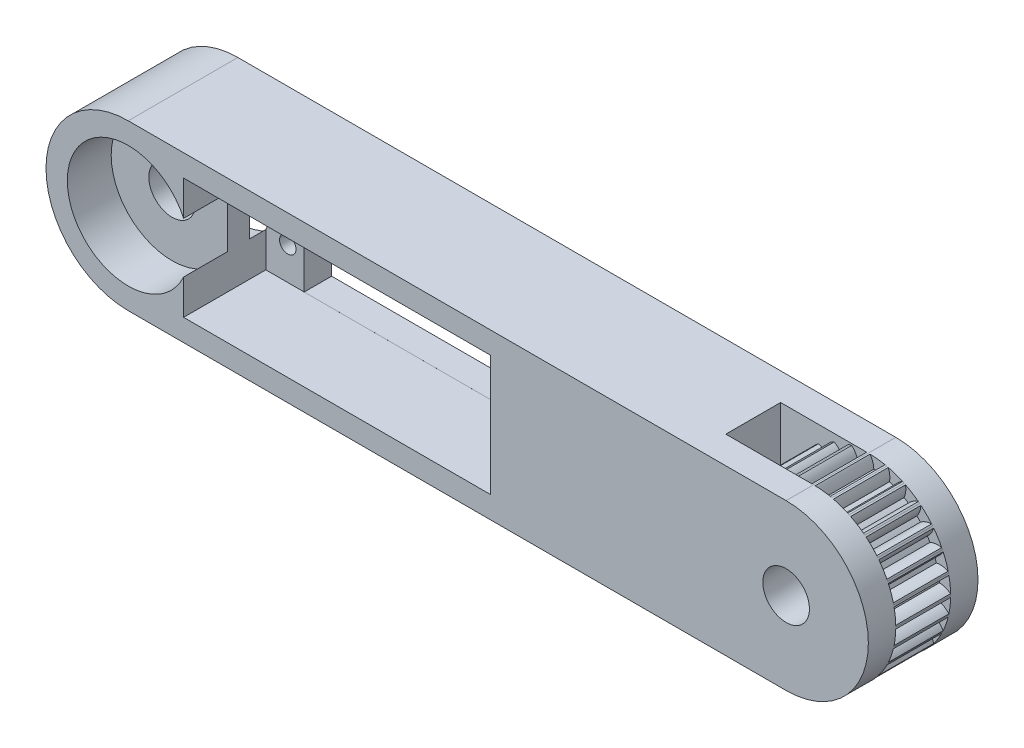
from build123d import *

# Parameters (mm, degrees)
BOSS_EXTRUDE1_DEPTH = 10
SKETCH3_R           = 4.25
CUT_EXTRUDE5_DEPTH  = 138.295302177
SKETCH4_R           = 4.25
SKETCH4_W           = 42
SKETCH4_H           = 22
CUT_EXTRUDE8_DEPTH  = 138.295302177
SKETCH5_R           = 11.11
CUT_EXTRUDE10_DEPTH = 8
SKETCH7_W           = 56
SKETCH7_H           = 22.002715538
CUT_EXTRUDE12_DEPTH = 15
SKETCH8_R           = 1.5
CUT_EXTRUDE13_DEPTH = 14
CUT_EXTRUDE17_DEPTH = 5
BOSS_EXTRUDE2_START = -5
SKETCH3_6_R         = 4.25
BOSS_EXTRUDE2_DEPTH = 10
BOSS_EXTRUDE3_START = -5
BOSS_EXTRUDE3_DEPTH = 10
CIRPATTERN1_COUNT   = 28
SKETCH10_R          = 9.5
CUT_EXTRUDE15_DEPTH = 5
SKETCH11_R          = 3.5
CUT_EXTRUDE16_DEPTH = 2


with BuildPart() as part:
    # Sketch1 → Boss-Extrude1 (new, symmetric)
    with BuildSketch(Plane.XY):
        with BuildLine():
            Line((120, 15), (0, 15))
            ThreePointArc((0, 15), (-15, 0), (0, -15))
            Line((0, -15), (120, -15))
            ThreePointArc((120, -15), (135, 0), (120, 15))
        make_face()
    extrude(amount=BOSS_EXTRUDE1_DEPTH, both=True)

    # Sketch3 → Cut-Extrude5 (cut, through all)
    with BuildSketch(Plane.XY.offset(10)):
        with Locations((120, 0)):
            Circle(SKETCH3_R)
    extrude(amount=-CUT_EXTRUDE5_DEPTH, mode=Mode.SUBTRACT)

    # Sketch4 → Cut-Extrude8 (cut, through all)
    with BuildSketch(Plane.XY.offset(10)):
        Circle(SKETCH4_R)
        with Locations((38.1, 0)):
            Rectangle(SKETCH4_W, SKETCH4_H)
    extrude(amount=-CUT_EXTRUDE8_DEPTH, mode=Mode.SUBTRACT)

    # Sketch5 → Cut-Extrude10 (cut)
    with BuildSketch(Plane(origin=(0, 0, -10), x_dir=(-1, 0, 0), z_dir=(0, 0, -1))):
        Circle(SKETCH5_R)
    cut_extrude10 = extrude(amount=-CUT_EXTRUDE10_DEPTH, mode=Mode.SUBTRACT)

    # Mirror2: Cut-Extrude10 across plane
    add(cut_extrude10.mirror(Plane.XY), mode=Mode.SUBTRACT)

    # Sketch7 → Cut-Extrude12 (cut)
    with BuildSketch(Plane.XY.offset(10)):
        with Locations((38.1, 0)):
            Rectangle(SKETCH7_W, SKETCH7_H)
    extrude(amount=-CUT_EXTRUDE12_DEPTH, mode=Mode.SUBTRACT)

    # Sketch8 → Cut-Extrude13 (cut)
    with BuildSketch(Plane.XY.offset(-5)):
        with Locations((14.1, 5)):
            Circle(SKETCH8_R)
        with Locations((14.1, -5)):
            Circle(SKETCH8_R)
        with Locations((62.1, -5)):
            Circle(SKETCH8_R)
        with Locations((62.1, 5)):
            Circle(SKETCH8_R)
    extrude(amount=-CUT_EXTRUDE13_DEPTH, mode=Mode.SUBTRACT)

    # Sketch13 → Cut-Extrude17 (cut, symmetric)
    with BuildSketch(Plane.XY):
        with BuildLine():
            Line((120, 15), (104, 15))
            Line((104, 15), (104, -15))
            Line((104, -15), (120, -15))
            ThreePointArc((120, -15), (135, 0), (120, 15))
        make_face()
    extrude(amount=CUT_EXTRUDE17_DEPTH, both=True, mode=Mode.SUBTRACT)

    # Sketch3<6> → Boss-Extrude2 (add)
    with BuildSketch(Plane.XY.offset(10).offset(BOSS_EXTRUDE2_START)):
        with BuildLine():
            ThreePointArc((133, 0), (129.539392014, 8.831760866), (121, 12.961481397))
            ThreePointArc((121, 12.961481397), (120, 13), (119, 12.961481397))
            ThreePointArc((119, 12.961481397), (111.168239134, -9.539392014), (133, 0))
        make_face()
        with Locations((120, 0)):
            Circle(SKETCH3_6_R, mode=Mode.SUBTRACT)
    extrude(amount=-BOSS_EXTRUDE2_DEPTH)

    # Sketch3<7> → Boss-Extrude3 (add)
    with BuildSketch(Plane.XY.offset(10).offset(BOSS_EXTRUDE3_START)):
        with BuildLine():
            ThreePointArc((120.302184784, 14.996955836), (120.151100058, 14.99923894), (120, 15))
            Line((120, 15), (119.7, 15))
            ThreePointArc((119.7, 15), (119.2, 14.03224869), (119, 12.961481397))
            ThreePointArc((119, 12.961481397), (120, 13), (121, 12.961481397))
            ThreePointArc((121, 12.961481397), (120.800608022, 14.030476584), (120.302184784, 14.996955836))
        make_face()
    boss_extrude3 = extrude(amount=-BOSS_EXTRUDE3_DEPTH)

    # CirPattern1: Boss-Extrude3 ×28 about axis
    cirpattern1_axis = Axis((120, 0, 0), (0, 0, 1))
    for i in range(1, CIRPATTERN1_COUNT):
        add(boss_extrude3.rotate(cirpattern1_axis, i * 360 / CIRPATTERN1_COUNT))

    # Sketch10 → Cut-Extrude15 (cut)
    with BuildSketch(Plane(origin=(0, 0, -10), x_dir=(-1, 0, 0), z_dir=(0, 0, -1))):
        with Locations((-120, 0)):
            Circle(SKETCH10_R)
    extrude(amount=-CUT_EXTRUDE15_DEPTH, mode=Mode.SUBTRACT)

    # Sketch11 → Cut-Extrude16 (cut)
    with BuildSketch(Plane(origin=(0, 0, -10), x_dir=(-1, 0, 0), z_dir=(0, 0, -1))):
        with Locations((-62.1, 5)):
            Circle(SKETCH11_R)
        with Locations((-62.1, -5)):
            Circle(SKETCH11_R)
        with Locations((-14.1, 5)):
            Circle(SKETCH11_R)
        with Locations((-14.1, -5)):
            Circle(SKETCH11_R)
    extrude(amount=-CUT_EXTRUDE16_DEPTH, mode=Mode.SUBTRACT)


solid = part.part
